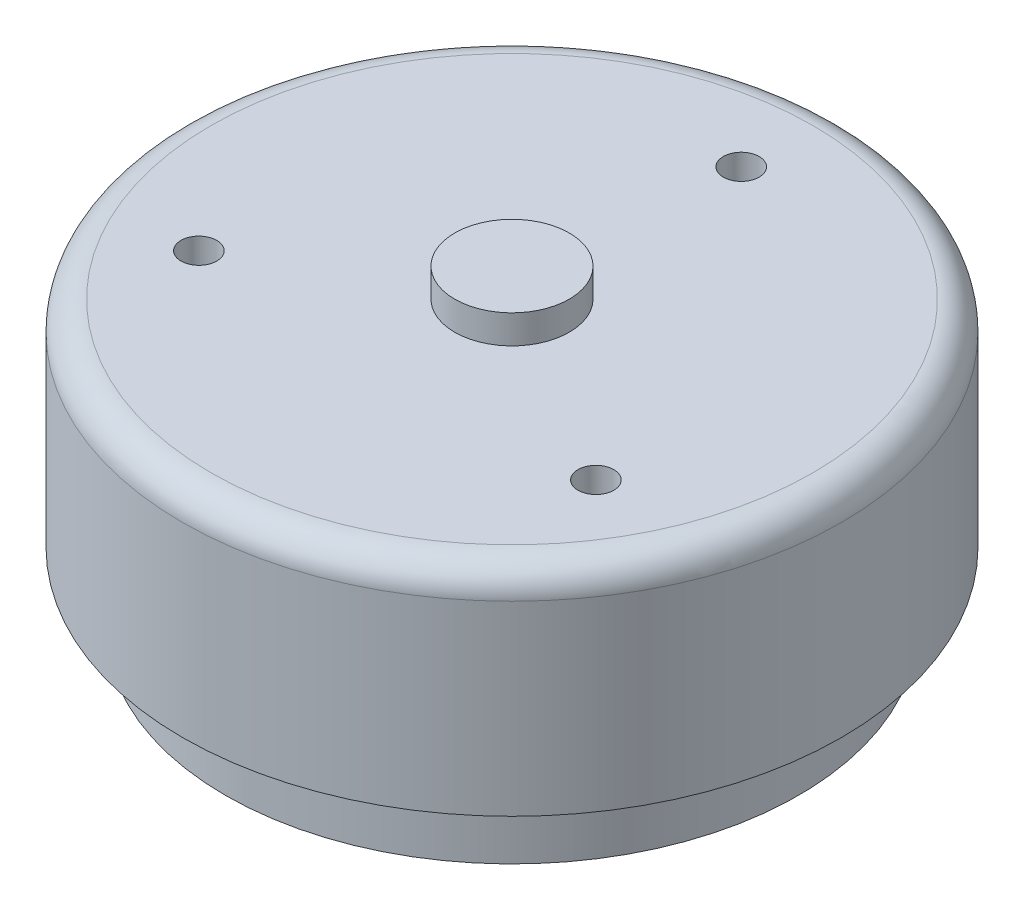
from build123d import *

# Parameters (mm, degrees)
SKETCH6_R           = 23
BOSS_EXTRUDE3_DEPTH = 25
SKETCH7_R           = 1.5
CUT_EXTRUDE2_DEPTH  = 5
SKETCH8_R           = 1.25
CUT_EXTRUDE3_DEPTH  = 5
SKETCH9_R           = 4
BOSS_EXTRUDE4_DEPTH = 2
SKETCH10_R          = 2
BOSS_EXTRUDE5_DEPTH = 3
FILLET1_R           = 5
FILLET2_R           = 2
SKETCH11_W          = 63.139776453
SKETCH11_H          = 24.157827512
CUT_EXTRUDE4_DEPTH  = 50
SKETCH12_R          = 20
BOSS_EXTRUDE6_DEPTH = 5


with BuildPart() as part:
    # Sketch6 → Boss-Extrude3 (new body)
    with BuildSketch(Plane(origin=(0, 0, 0), x_dir=(1, 0, 0), z_dir=(0, 1, 0))):
        with Locations(Location((0, 0, 0), (0, 0, 270))):
            Circle(SKETCH6_R)
    extrude(amount=BOSS_EXTRUDE3_DEPTH)

    # Sketch7 → Cut-Extrude2 (cut)
    with BuildSketch(Plane(origin=(0, 0, 0), x_dir=(1, 0, 0), z_dir=(0, 1, 0))):
        with Locations(Location((-6, 0, 0), (0, 0, 270))):
            Circle(SKETCH7_R)
        with Locations(Location((0, 6, 0), (0, 0, 270))):
            Circle(SKETCH7_R)
        with Locations(Location((6, 0, 0), (0, 0, 270))):
            Circle(SKETCH7_R)
        with Locations(Location((0, -6, 0), (0, 0, 270))):
            Circle(SKETCH7_R)
    extrude(amount=CUT_EXTRUDE2_DEPTH, mode=Mode.SUBTRACT)

    # Sketch8 → Cut-Extrude3 (cut)
    with BuildSketch(Plane(origin=(0, 25, 0), x_dir=(1, 0, 0), z_dir=(0, 1, 0))):
        with Locations(Location((-13.856406461, -8, 0), (0, 0, 270))):
            Circle(SKETCH8_R)
        with Locations(Location((0, 16, 0), (0, 0, 270))):
            Circle(SKETCH8_R)
        with Locations(Location((13.856406461, -8, 0), (0, 0, 270))):
            Circle(SKETCH8_R)
    extrude(amount=-CUT_EXTRUDE3_DEPTH, mode=Mode.SUBTRACT)

    # Sketch9 → Boss-Extrude4 (add)
    with BuildSketch(Plane(origin=(0, 25, 0), x_dir=(1, 0, 0), z_dir=(0, 1, 0))):
        with Locations(Location((0, 0, 0), (0, 0, 270))):
            Circle(SKETCH9_R)
    extrude(amount=BOSS_EXTRUDE4_DEPTH)

    # Sketch10 → Boss-Extrude5 (add)
    with BuildSketch(Plane.XZ):
        with Locations(Location((0, 0, 0), (0, 0, 90))):
            Circle(SKETCH10_R)
    extrude(amount=BOSS_EXTRUDE5_DEPTH)

    # Fillet1
    fillet1_edges = [part.edges().sort_by_distance(p)[0] for p in [
        (0, 0, -23),
    ]]
    fillet(fillet1_edges, radius=FILLET1_R)

    # Fillet2
    fillet2_edges = [part.edges().sort_by_distance(p)[0] for p in [
        (0, 25, -23),
    ]]
    fillet(fillet2_edges, radius=FILLET2_R)

    # Sketch11 → Cut-Extrude4 (cut, symmetric)
    with BuildSketch(Plane(origin=(0, 0, 0), x_dir=(0, 0, -1), z_dir=(1, 0, 0))):
        with Locations((5.009304592, -2.078913756)):
            Rectangle(SKETCH11_W, SKETCH11_H)
    extrude(amount=CUT_EXTRUDE4_DEPTH, both=True, mode=Mode.SUBTRACT)

    # Sketch12 → Boss-Extrude6 (add)
    with BuildSketch(Plane.XZ.offset(-10)):
        with Locations(Location((0, 0, 0), (0, 0, 90))):
            Circle(SKETCH12_R)
    extrude(amount=BOSS_EXTRUDE6_DEPTH)


solid = part.part
